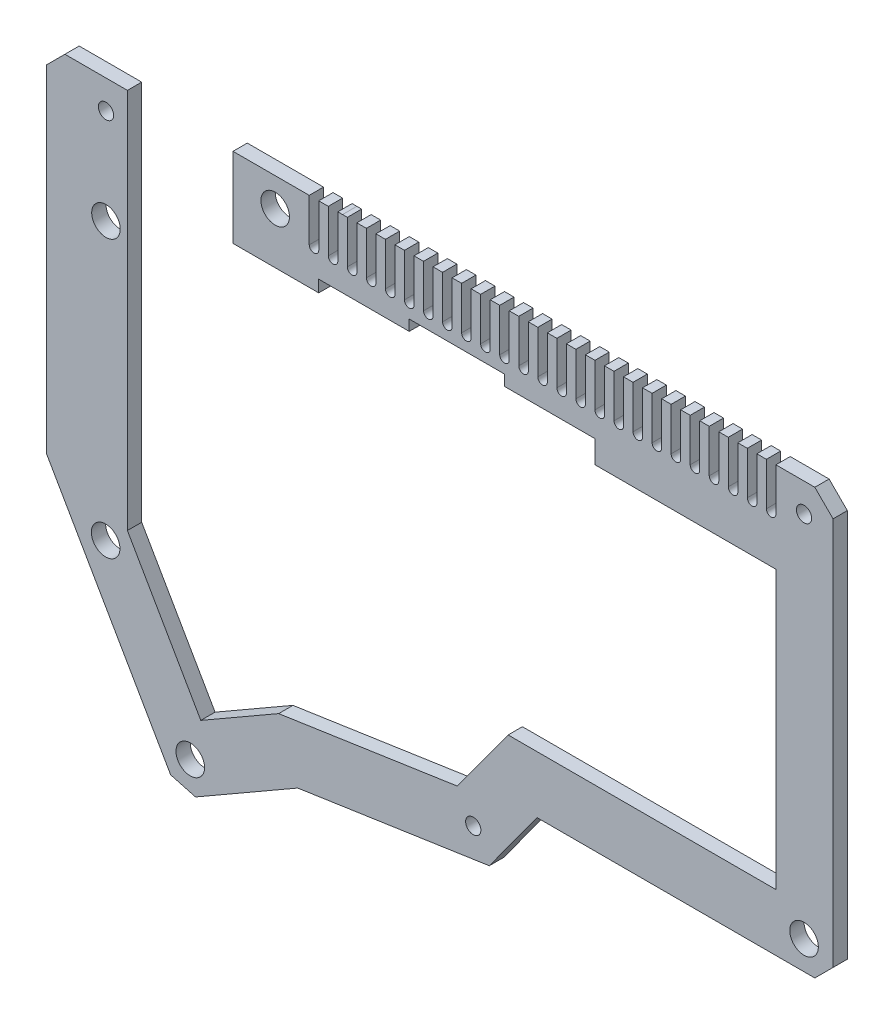
from build123d import *

# Parameters (mm, degrees)
BOSS_EXTRU_2_DEPTH      = 3
ENL_V_MAT_EXTRU_1_DEPTH = 3
ESQUISSE3_R             = 3
ESQUISSE3_R_2           = 1.6
ENL_V_MAT_EXTRU_3_DEPTH = 10


with BuildPart() as part:
    # Esquisse1 → Boss.-Extru.2 (new body)
    with BuildSketch(Plane.XY):
        Polygon((-140.02282508, -78.342807898), (-126.111124489, -102.556497988), (-109.761976756, -93.1463556), (-72.263087593, -87.572177036), (-61.577157206, -72.933633781), (-5.339106961, -72.933633781), (-5.339106961, -14.679643994), (-43.341802282, -14.679643994), (-43.341802282, -9.929307079), (-62.343149943, -9.929307079), (-62.343149943, -7.681038584), (-82.344426674, -7.679926158), (-82.344426674, -9.929307079), (-101.345774335, -9.929307079), (-101.345774335, -12.429484403), (-119.346382005, -12.429484403), (-119.346315028, 4.320852512), (-103.340940531, 4.320852512), (-96.344482292, 4.320852512), (2.832387268, 4.315336518), (6.660893039, 0.486617808), (6.660893039, -81.105206657), (2.832465915, -84.933633781), (-55.479847181, -84.933633781), (-65.531582138, -98.70339941), (-105.747438988, -104.681452952), (-127.216265437, -117.03834868), (-132.440036759, -115.628996046), (-158.478985875, -70.307502815), (-158.478985875, -3.429484403), (-158.478985875, 0.492425388), (-154.65055875, 4.320852512), (-141.52282508, 4.320852512), (-141.52282508, -75.180151251), (-141.52282508, -75.732017442), (-140.889904197, -76.833633309), align=None)
    extrude(amount=BOSS_EXTRU_2_DEPTH)

    # Esquisse2 → Enlèv. mat.-Extru.1 (cut)
    with BuildSketch(Plane.XY.offset(3)):
        with BuildLine():
            Line((-5.339106961, 6.582149677), (-5.339106961, -4.684153384))
            ThreePointArc((-5.339106961, -4.684153384), (-6.339106961, -5.684153384), (-7.339106961, -4.684153384))
            Line((-7.339106961, -4.684153384), (-7.339106961, 6.582149677))
            ThreePointArc((-7.339106961, 6.582149677), (-6.339106961, 7.582149677), (-5.339106961, 6.582149677))
        make_face()
        with BuildLine():
            Line((-9.339106961, 6.582149677), (-9.339106961, -4.684153384))
            ThreePointArc((-9.339106961, -4.684153384), (-10.339106961, -5.684153384), (-11.339106961, -4.684153384))
            Line((-11.339106961, -4.684153384), (-11.339106961, 6.582149677))
            ThreePointArc((-11.339106961, 6.582149677), (-10.339106961, 7.582149677), (-9.339106961, 6.582149677))
        make_face()
        with BuildLine():
            Line((-13.339106961, 6.582149677), (-13.339106961, -4.684153384))
            ThreePointArc((-13.339106961, -4.684153384), (-14.339106961, -5.684153384), (-15.339106961, -4.684153384))
            Line((-15.339106961, -4.684153384), (-15.339106961, 6.582149677))
            ThreePointArc((-15.339106961, 6.582149677), (-14.339106961, 7.582149677), (-13.339106961, 6.582149677))
        make_face()
        with BuildLine():
            Line((-17.339106961, 6.582149677), (-17.339106961, -4.684153384))
            ThreePointArc((-17.339106961, -4.684153384), (-18.339106961, -5.684153384), (-19.339106961, -4.684153384))
            Line((-19.339106961, -4.684153384), (-19.339106961, 6.582149677))
            ThreePointArc((-19.339106961, 6.582149677), (-18.339106961, 7.582149677), (-17.339106961, 6.582149677))
        make_face()
        with BuildLine():
            Line((-21.339106961, 6.582149677), (-21.339106961, -4.684153384))
            ThreePointArc((-21.339106961, -4.684153384), (-22.339106961, -5.684153384), (-23.339106961, -4.684153384))
            Line((-23.339106961, -4.684153384), (-23.339106961, 6.582149677))
            ThreePointArc((-23.339106961, 6.582149677), (-22.339106961, 7.582149677), (-21.339106961, 6.582149677))
        make_face()
        with BuildLine():
            Line((-25.339106961, 6.582149677), (-25.339106961, -4.684153384))
            ThreePointArc((-25.339106961, -4.684153384), (-26.339106961, -5.684153384), (-27.339106961, -4.684153384))
            Line((-27.339106961, -4.684153384), (-27.339106961, 6.582149677))
            ThreePointArc((-27.339106961, 6.582149677), (-26.339106961, 7.582149677), (-25.339106961, 6.582149677))
        make_face()
        with BuildLine():
            Line((-29.339106961, 6.582149677), (-29.339106961, -4.684153384))
            ThreePointArc((-29.339106961, -4.684153384), (-30.339106961, -5.684153384), (-31.339106961, -4.684153384))
            Line((-31.339106961, -4.684153384), (-31.339106961, 6.582149677))
            ThreePointArc((-31.339106961, 6.582149677), (-30.339106961, 7.582149677), (-29.339106961, 6.582149677))
        make_face()
        with BuildLine():
            Line((-33.339106961, 6.582149677), (-33.339106961, -4.684153384))
            ThreePointArc((-33.339106961, -4.684153384), (-34.339106961, -5.684153384), (-35.339106961, -4.684153384))
            Line((-35.339106961, -4.684153384), (-35.339106961, 6.582149677))
            ThreePointArc((-35.339106961, 6.582149677), (-34.339106961, 7.582149677), (-33.339106961, 6.582149677))
        make_face()
        with BuildLine():
            Line((-37.339106961, 6.582149677), (-37.339106961, -4.684153384))
            ThreePointArc((-37.339106961, -4.684153384), (-38.339106961, -5.684153384), (-39.339106961, -4.684153384))
            Line((-39.339106961, -4.684153384), (-39.339106961, 6.582149677))
            ThreePointArc((-39.339106961, 6.582149677), (-38.339106961, 7.582149677), (-37.339106961, 6.582149677))
        make_face()
        with BuildLine():
            Line((-41.339106961, 6.582149677), (-41.339106961, -4.684153384))
            ThreePointArc((-41.339106961, -4.684153384), (-42.339106961, -5.684153384), (-43.339106961, -4.684153384))
            Line((-43.339106961, -4.684153384), (-43.339106961, 6.582149677))
            ThreePointArc((-43.339106961, 6.582149677), (-42.339106961, 7.582149677), (-41.339106961, 6.582149677))
        make_face()
        with BuildLine():
            Line((-45.339106961, 6.582149677), (-45.339106961, -4.684153384))
            ThreePointArc((-45.339106961, -4.684153384), (-46.339106961, -5.684153384), (-47.339106961, -4.684153384))
            Line((-47.339106961, -4.684153384), (-47.339106961, 6.582149677))
            ThreePointArc((-47.339106961, 6.582149677), (-46.339106961, 7.582149677), (-45.339106961, 6.582149677))
        make_face()
        with BuildLine():
            Line((-49.339106961, 6.582149677), (-49.339106961, -4.684153384))
            ThreePointArc((-49.339106961, -4.684153384), (-50.339106961, -5.684153384), (-51.339106961, -4.684153384))
            Line((-51.339106961, -4.684153384), (-51.339106961, 6.582149677))
            ThreePointArc((-51.339106961, 6.582149677), (-50.339106961, 7.582149677), (-49.339106961, 6.582149677))
        make_face()
        with BuildLine():
            Line((-53.339106961, 6.582149677), (-53.339106961, -4.684153384))
            ThreePointArc((-53.339106961, -4.684153384), (-54.339106961, -5.684153384), (-55.339106961, -4.684153384))
            Line((-55.339106961, -4.684153384), (-55.339106961, 6.582149677))
            ThreePointArc((-55.339106961, 6.582149677), (-54.339106961, 7.582149677), (-53.339106961, 6.582149677))
        make_face()
        with BuildLine():
            Line((-57.339106961, 6.582149677), (-57.339106961, -4.684153384))
            ThreePointArc((-57.339106961, -4.684153384), (-58.339106961, -5.684153384), (-59.339106961, -4.684153384))
            Line((-59.339106961, -4.684153384), (-59.339106961, 6.582149677))
            ThreePointArc((-59.339106961, 6.582149677), (-58.339106961, 7.582149677), (-57.339106961, 6.582149677))
        make_face()
        with BuildLine():
            Line((-61.339106961, 6.582149677), (-61.339106961, -4.684153384))
            ThreePointArc((-61.339106961, -4.684153384), (-62.339106961, -5.684153384), (-63.339106961, -4.684153384))
            Line((-63.339106961, -4.684153384), (-63.339106961, 6.582149677))
            ThreePointArc((-63.339106961, 6.582149677), (-62.339106961, 7.582149677), (-61.339106961, 6.582149677))
        make_face()
        with BuildLine():
            Line((-65.339106961, 6.582149677), (-65.339106961, -4.684153384))
            ThreePointArc((-65.339106961, -4.684153384), (-66.339106961, -5.684153384), (-67.339106961, -4.684153384))
            Line((-67.339106961, -4.684153384), (-67.339106961, 6.582149677))
            ThreePointArc((-67.339106961, 6.582149677), (-66.339106961, 7.582149677), (-65.339106961, 6.582149677))
        make_face()
        with BuildLine():
            Line((-69.339106961, 6.582149677), (-69.339106961, -4.684153384))
            ThreePointArc((-69.339106961, -4.684153384), (-70.339106961, -5.684153384), (-71.339106961, -4.684153384))
            Line((-71.339106961, -4.684153384), (-71.339106961, 6.582149677))
            ThreePointArc((-71.339106961, 6.582149677), (-70.339106961, 7.582149677), (-69.339106961, 6.582149677))
        make_face()
        with BuildLine():
            Line((-73.339106961, 6.582149677), (-73.339106961, -4.684153384))
            ThreePointArc((-73.339106961, -4.684153384), (-74.339106961, -5.684153384), (-75.339106961, -4.684153384))
            Line((-75.339106961, -4.684153384), (-75.339106961, 6.582149677))
            ThreePointArc((-75.339106961, 6.582149677), (-74.339106961, 7.582149677), (-73.339106961, 6.582149677))
        make_face()
        with BuildLine():
            Line((-77.339106961, 6.582149677), (-77.339106961, -4.684153384))
            ThreePointArc((-77.339106961, -4.684153384), (-78.339106961, -5.684153384), (-79.339106961, -4.684153384))
            Line((-79.339106961, -4.684153384), (-79.339106961, 6.582149677))
            ThreePointArc((-79.339106961, 6.582149677), (-78.339106961, 7.582149677), (-77.339106961, 6.582149677))
        make_face()
        with BuildLine():
            Line((-81.339106961, 6.582149677), (-81.339106961, -4.684153384))
            ThreePointArc((-81.339106961, -4.684153384), (-82.339106961, -5.684153384), (-83.339106961, -4.684153384))
            Line((-83.339106961, -4.684153384), (-83.339106961, 6.582149677))
            ThreePointArc((-83.339106961, 6.582149677), (-82.339106961, 7.582149677), (-81.339106961, 6.582149677))
        make_face()
        with BuildLine():
            Line((-85.339106961, 6.582149677), (-85.339106961, -4.684153384))
            ThreePointArc((-85.339106961, -4.684153384), (-86.339106961, -5.684153384), (-87.339106961, -4.684153384))
            Line((-87.339106961, -4.684153384), (-87.339106961, 6.582149677))
            ThreePointArc((-87.339106961, 6.582149677), (-86.339106961, 7.582149677), (-85.339106961, 6.582149677))
        make_face()
        with BuildLine():
            Line((-89.339106961, 6.582149677), (-89.339106961, -4.684153384))
            ThreePointArc((-89.339106961, -4.684153384), (-90.339106961, -5.684153384), (-91.339106961, -4.684153384))
            Line((-91.339106961, -4.684153384), (-91.339106961, 6.582149677))
            ThreePointArc((-91.339106961, 6.582149677), (-90.339106961, 7.582149677), (-89.339106961, 6.582149677))
        make_face()
        with BuildLine():
            Line((-93.339106961, 6.582149677), (-93.339106961, -4.684153384))
            ThreePointArc((-93.339106961, -4.684153384), (-94.339106961, -5.684153384), (-95.339106961, -4.684153384))
            Line((-95.339106961, -4.684153384), (-95.339106961, 6.582149677))
            ThreePointArc((-95.339106961, 6.582149677), (-94.339106961, 7.582149677), (-93.339106961, 6.582149677))
        make_face()
        with BuildLine():
            Line((-97.339106961, 6.582149677), (-97.339106961, -4.684153384))
            ThreePointArc((-97.339106961, -4.684153384), (-98.339106961, -5.684153384), (-99.339106961, -4.684153384))
            Line((-99.339106961, -4.684153384), (-99.339106961, 6.582149677))
            ThreePointArc((-99.339106961, 6.582149677), (-98.339106961, 7.582149677), (-97.339106961, 6.582149677))
        make_face()
        with BuildLine():
            Line((-101.339106961, 6.582149677), (-101.339106961, -4.684153384))
            ThreePointArc((-101.339106961, -4.684153384), (-102.339106961, -5.684153384), (-103.339106961, -4.684153384))
            Line((-103.339106961, -4.684153384), (-103.339106961, 6.582149677))
            ThreePointArc((-103.339106961, 6.582149677), (-102.339106961, 7.582149677), (-101.339106961, 6.582149677))
        make_face()
    extrude(amount=-ENL_V_MAT_EXTRU_1_DEPTH, mode=Mode.SUBTRACT)

    # Esquisse3 → Enlèv. mat.-Extru.3 (cut)
    with BuildSketch(Plane.XY):
        with Locations(Location((-110.487646531, -1.678365923, 0), (0, 0, 180))):
            Circle(ESQUISSE3_R)
        with Locations(Location((-146.0923789, -79.822656053, 0), (0, 0, 180))):
            Circle(ESQUISSE3_R)
        with Locations(Location((-128.322250168, -110.752044388, 0), (0, 0, 180))):
            Circle(ESQUISSE3_R)
        with Locations(Location((0.570331496, -78.933633781, 0), (0, 0, 180))):
            Circle(ESQUISSE3_R)
        with Locations(Location((-68.897334865, -93.137788223, 0), (0, 0, 180))):
            Circle(ESQUISSE3_R_2)
        with Locations(Location((-146.02282508, -1.677868186, 0), (0, 0, 180))):
            Circle(ESQUISSE3_R_2)
        with Locations(Location((0.570331496, -1.684542717, 0), (0, 0, 180))):
            Circle(ESQUISSE3_R_2)
        with Locations(Location((-146.02282508, -21.677868186, 0), (0, 0, 180))):
            Circle(ESQUISSE3_R)
    extrude(amount=ENL_V_MAT_EXTRU_3_DEPTH, mode=Mode.SUBTRACT)


solid = part.part
